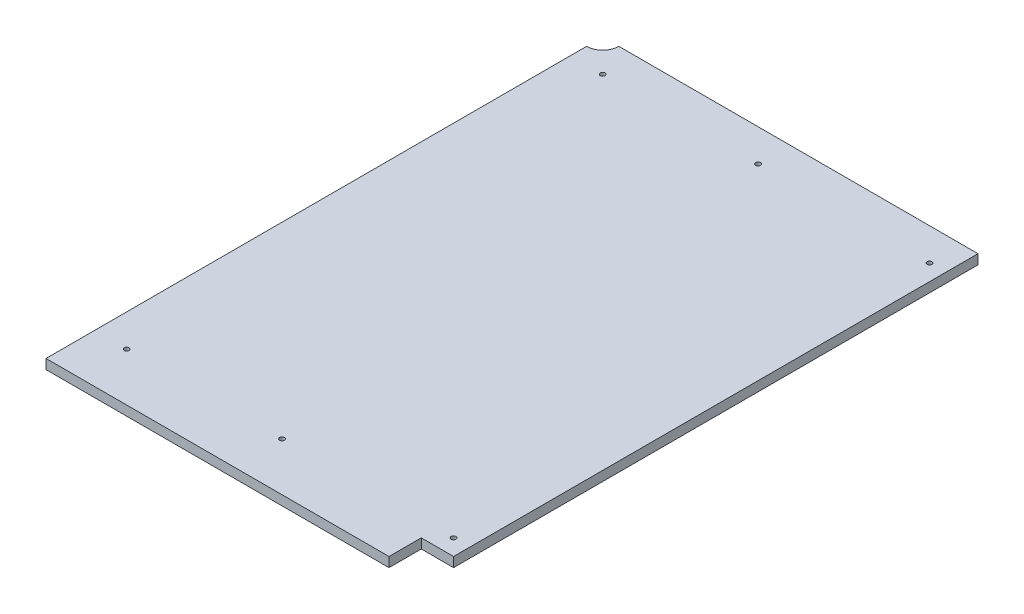
from build123d import *

# Parameters (mm, degrees)
SKETCH_1_R      = 1.5
EXTRUDE_1_DEPTH = 6


with BuildPart() as part:
    # 草图1 → 凸台-拉伸1 (new body)
    with BuildSketch(Plane(origin=(0, 0, 0), x_dir=(1, 0, 0), z_dir=(0, 1, 0))):
        with BuildLine():
            Line((-102.725, 113.5), (119.825, 113.5))
            Line((119.825, 113.5), (119.825, -211.5))
            Line((119.825, -211.5), (99.825, -211.5))
            Line((99.825, -211.5), (99.825, -231.5))
            Line((99.825, -231.5), (-112.725, -231.5))
            Line((-112.725, -231.5), (-112.725, 103.5))
            ThreePointArc((-112.725, 103.5), (-105.653932188, 106.428932188), (-102.725, 113.5))
        make_face()
        with Locations(Location((-92.725, 93.5, 0), (0, 0, 270))):
            Circle(SKETCH_1_R, mode=Mode.SUBTRACT)
        with Locations(Location((109.825, 93.5, 0), (0, 0, 270))):
            Circle(SKETCH_1_R, mode=Mode.SUBTRACT)
        with Locations(Location((3.55, 93.5, 0), (0, 0, 270))):
            Circle(SKETCH_1_R, mode=Mode.SUBTRACT)
        with Locations(Location((-92.725, -201.5, 0), (0, 0, 270))):
            Circle(SKETCH_1_R, mode=Mode.SUBTRACT)
        with Locations(Location((3.55, -201.5, 0), (0, 0, 270))):
            Circle(SKETCH_1_R, mode=Mode.SUBTRACT)
        with Locations(Location((109.825, -201.5, 0), (0, 0, 270))):
            Circle(SKETCH_1_R, mode=Mode.SUBTRACT)
    extrude(amount=EXTRUDE_1_DEPTH)


solid = part.part
